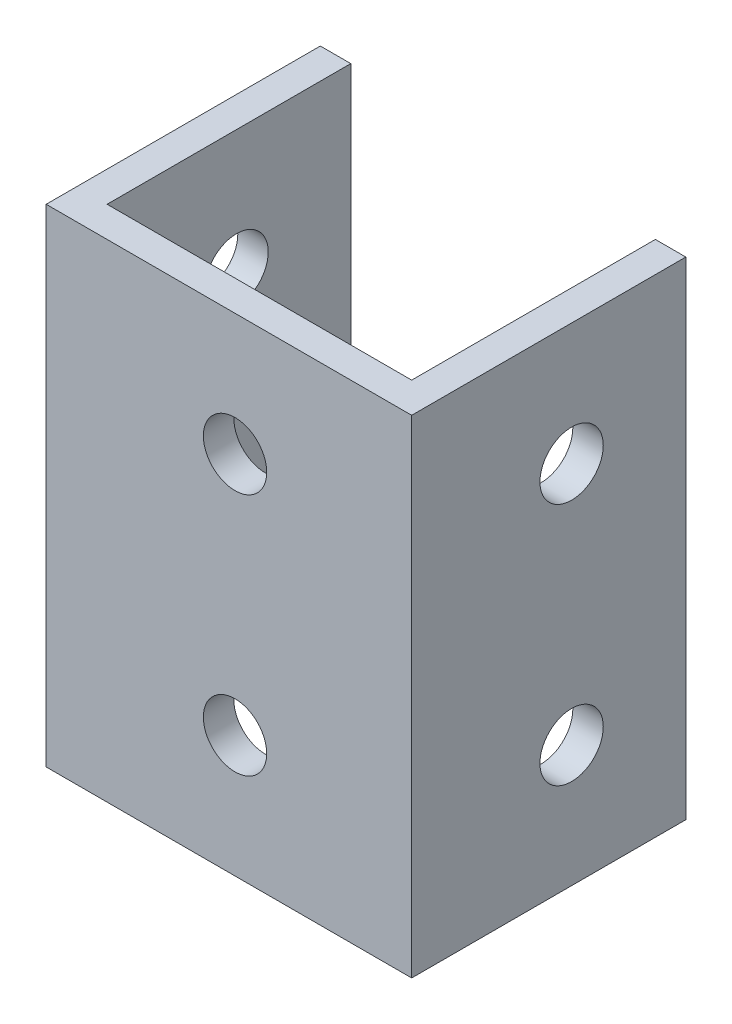
from build123d import *

# Parameters (mm, degrees)
BOSS_EXTRUDE1_DEPTH = 50.8
SKETCH3_R           = 3.302
CUT_EXTRUDE1_DEPTH  = 50.8
SKETCH4_R           = 3.302
CUT_EXTRUDE2_DEPTH  = 70.633186233


with BuildPart() as part:
    # Sketch2 → Boss-Extrude1 (new body)
    with BuildSketch(Plane(origin=(0, 0, 0), x_dir=(1, 0, 0), z_dir=(0, 1, 0))):
        Polygon((0, 0), (0, -28.575), (38.1, -28.575), (38.1, 0), (34.925, 0), (34.925, -25.4), (3.175, -25.4), (3.175, 0), align=None)
    extrude(amount=BOSS_EXTRUDE1_DEPTH)

    # Sketch3 → Cut-Extrude1 (cut)
    with BuildSketch(Plane(origin=(0, 0, 25.4), x_dir=(-1, 0, 0), z_dir=(0, 0, -1))):
        with Locations((-19.685, 12.7)):
            Circle(SKETCH3_R)
        with Locations((-19.685, 38.091107032)):
            Circle(SKETCH3_R)
    extrude(amount=-CUT_EXTRUDE1_DEPTH, mode=Mode.SUBTRACT)

    # Sketch4 → Cut-Extrude2 (cut, through all)
    with BuildSketch(Plane(origin=(38.1, 0, 0), x_dir=(0, 0, -1), z_dir=(1, 0, 0))):
        with Locations((-11.90625, 38.1)):
            Circle(SKETCH4_R)
        with Locations((-11.90625, 12.7)):
            Circle(SKETCH4_R)
    extrude(amount=-CUT_EXTRUDE2_DEPTH, mode=Mode.SUBTRACT)


solid = part.part
